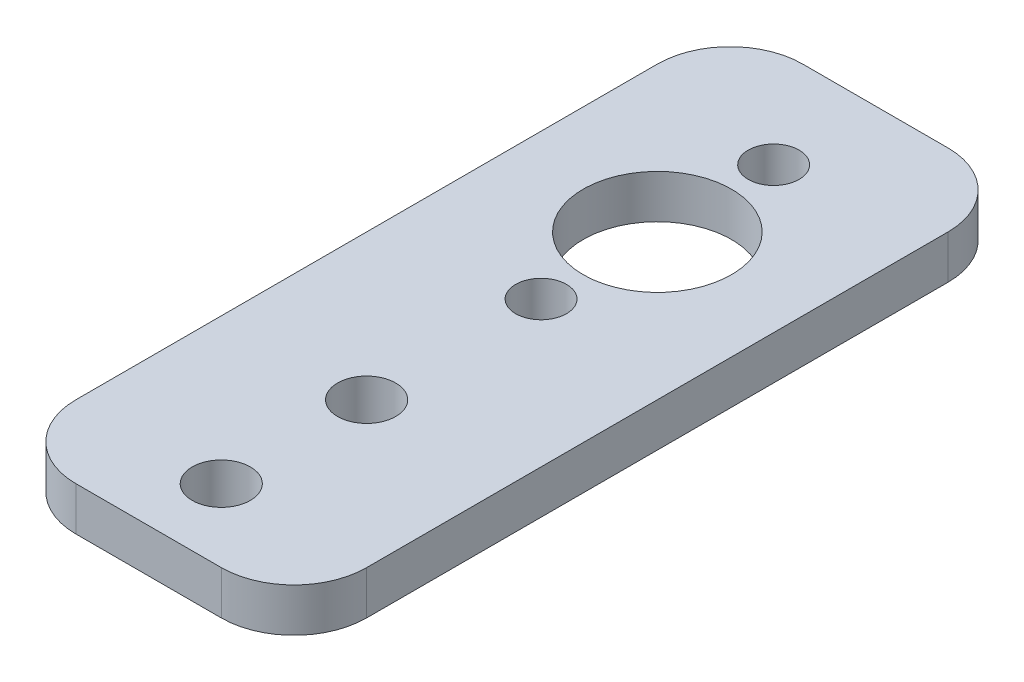
from build123d import *

# Parameters (mm, degrees)
SKETCH1_W           = 20
SKETCH1_H           = 50
BOSS_EXTRUDE1_DEPTH = 3
SKETCH2_R           = 5.1
SKETCH2_R_2         = 1.75
SKETCH2_R_3         = 2
CUT_EXTRUDE1_DEPTH  = 28.092434368
FILLET1_R           = 5


with BuildPart() as part:
    # Sketch1 → Boss-Extrude1 (new body)
    with BuildSketch(Plane(origin=(0, 0, 0), x_dir=(1, 0, 0), z_dir=(0, 1, 0))):
        Rectangle(SKETCH1_W, SKETCH1_H)
    extrude(amount=BOSS_EXTRUDE1_DEPTH)

    # Sketch2 → Cut-Extrude1 (cut, through all)
    with BuildSketch(Plane(origin=(0, 3, 0), x_dir=(1, 0, 0), z_dir=(0, 1, 0))):
        with Locations(Location((0, 10, 0), (0, 0, 270))):
            Circle(SKETCH2_R)
        with Locations(Location((0, 18, 0), (0, 0, 270))):
            Circle(SKETCH2_R_2)
        with Locations(Location((0, 2, 0), (0, 0, 270))):
            Circle(SKETCH2_R_2)
        with Locations(Location((0, -10, 0), (0, 0, 270))):
            Circle(SKETCH2_R_3)
        with Locations(Location((0, -20, 0), (0, 0, 270))):
            Circle(SKETCH2_R_3)
    extrude(amount=-CUT_EXTRUDE1_DEPTH, mode=Mode.SUBTRACT)

    # Fillet1
    fillet1_edges = [part.edges().sort_by_distance(p)[0] for p in [
        (10, 1.5, 25),
        (-10, 1.5, 25),
        (-10, 1.5, -25),
        (10, 1.5, -25),
    ]]
    fillet(fillet1_edges, radius=FILLET1_R)


solid = part.part
